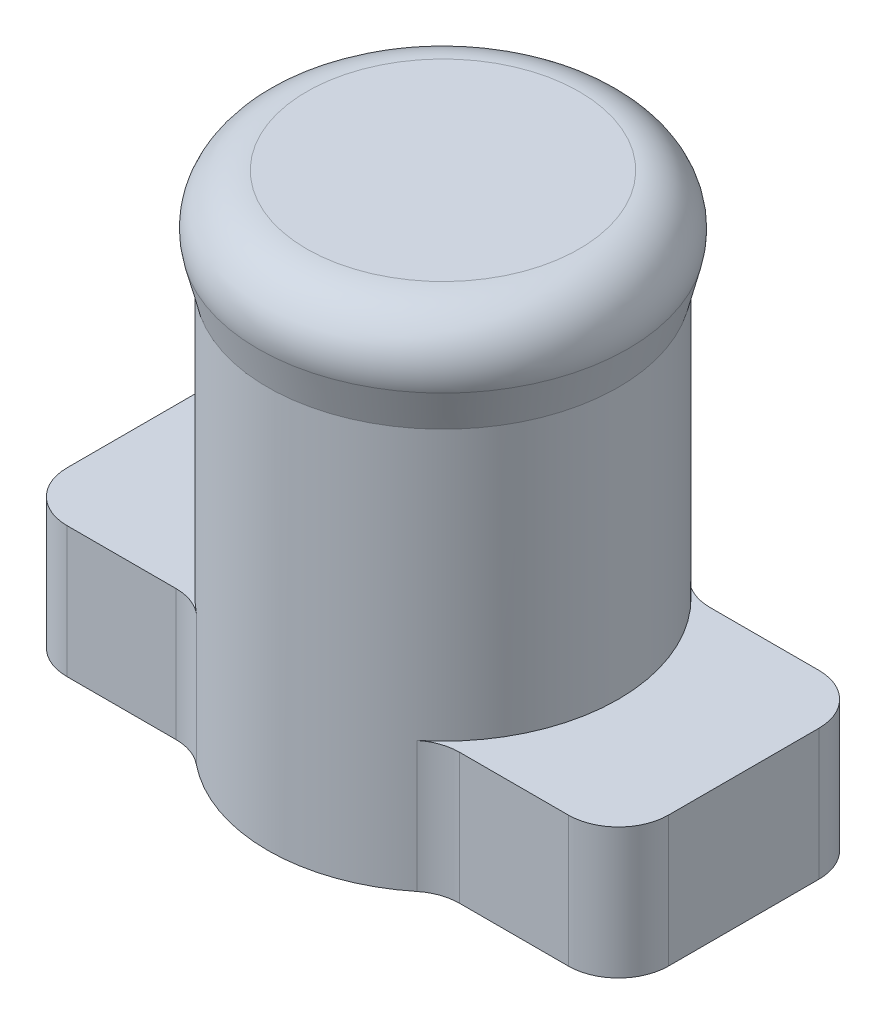
from build123d import *

# Parameters (mm, degrees)
SKETCH3_W           = 3.6
SKETCH3_H           = 3.6
CUT_EXTRUDE2_DEPTH  = 3.5
SKETCH4_W           = 4.2
SKETCH4_H           = 5
BOSS_EXTRUDE1_DEPTH = 2.61
FILLET1_R           = 1


with BuildPart() as part:
    # Sketch1 → Revolve1 (revolve)
    with BuildSketch(Plane.XY, mode=Mode.PRIVATE) as revolve1_sk:
        Polygon((0, 0), (0, 10), (4, 10), (3.5, 8), (3.5, 0), align=None)
    revolve(revolve1_sk.sketch.rotate(Axis((0, 0, 0), (0, 1, 0)), 90), axis=Axis((0, 0, 0), (0, 1, 0)))

    # Sketch3 → Cut-Extrude2 (cut)
    with BuildSketch(Plane.XZ):
        Rectangle(SKETCH3_W, SKETCH3_H)
    extrude(amount=-CUT_EXTRUDE2_DEPTH, mode=Mode.SUBTRACT)

    # Sketch4 → Boss-Extrude1 (add)
    with BuildSketch(Plane(origin=(0, 0, 0), x_dir=(1, 0, 0), z_dir=(0, 1, 0))):
        with Locations((-3.9, 0)):
            Rectangle(SKETCH4_W, SKETCH4_H)
        with Locations((3.9, 0)):
            Rectangle(SKETCH4_W, SKETCH4_H)
    extrude(amount=BOSS_EXTRUDE1_DEPTH)

    # Fillet1
    fillet1_edges = [part.edges().sort_by_distance(p)[0] for p in [
        (-2.449489743, 1.305, -2.5),
        (-2.449489743, 1.305, 2.5),
        (-6, 1.305, -2.5),
        (-6, 1.305, 2.5),
        (0, 10, 4),
        (2.449489743, 1.305, 2.5),
        (2.449489743, 1.305, -2.5),
        (6, 1.305, 2.5),
        (6, 1.305, -2.5),
    ]]
    fillet(fillet1_edges, radius=FILLET1_R)


solid = part.part
